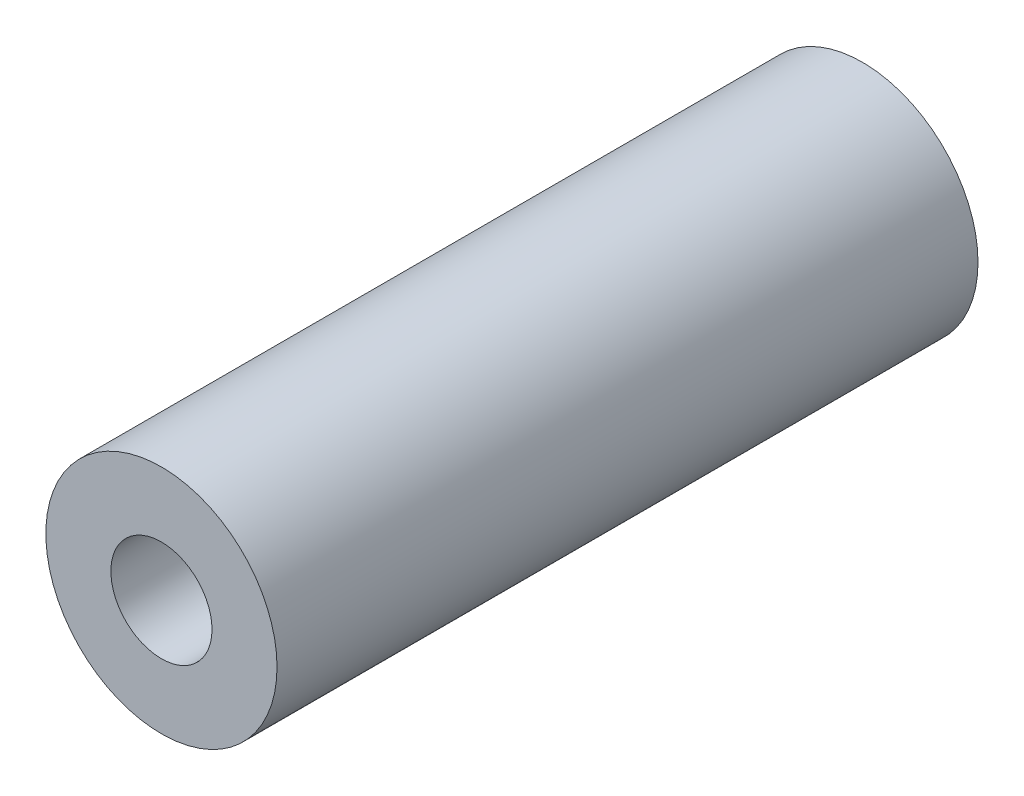
from build123d import *

# Parameters (mm, degrees)
ESQUISSE1_R        = 8
ESQUISSE1_R_2      = 3.5
BOSS_EXTRU_1_DEPTH = 48.514


with BuildPart() as part:
    # Esquisse1 → Boss.-Extru.1 (new body)
    with BuildSketch(Plane.XY):
        Circle(ESQUISSE1_R)
        Circle(ESQUISSE1_R_2, mode=Mode.SUBTRACT)
    extrude(amount=BOSS_EXTRU_1_DEPTH)


solid = part.part
